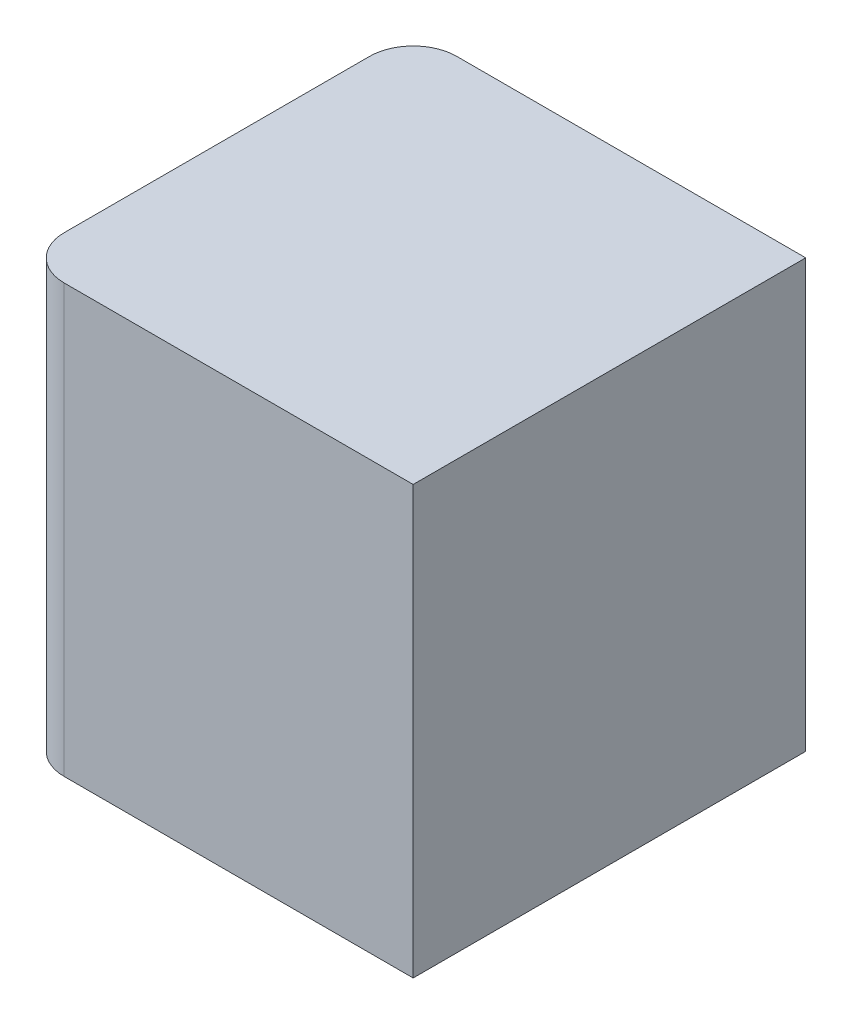
from build123d import *

# Parameters (mm, degrees)
SKETCH1_W           = 22.86
SKETCH1_H           = 22.86
BOSS_EXTRUDE1_DEPTH = 24.892
FILLET1_R           = 2.54


with BuildPart() as part:
    # Sketch1 → Boss-Extrude1 (new body)
    with BuildSketch(Plane(origin=(0, 0, 0), x_dir=(1, 0, 0), z_dir=(0, 1, 0))):
        with Locations((11.43, -11.43)):
            Rectangle(SKETCH1_W, SKETCH1_H)
    extrude(amount=BOSS_EXTRUDE1_DEPTH)

    # Fillet1
    fillet1_edges = [part.edges().sort_by_distance(p)[0] for p in [
        (0, 12.446, 0),
        (0, 12.446, 22.86),
    ]]
    fillet(fillet1_edges, radius=FILLET1_R)


solid = part.part
